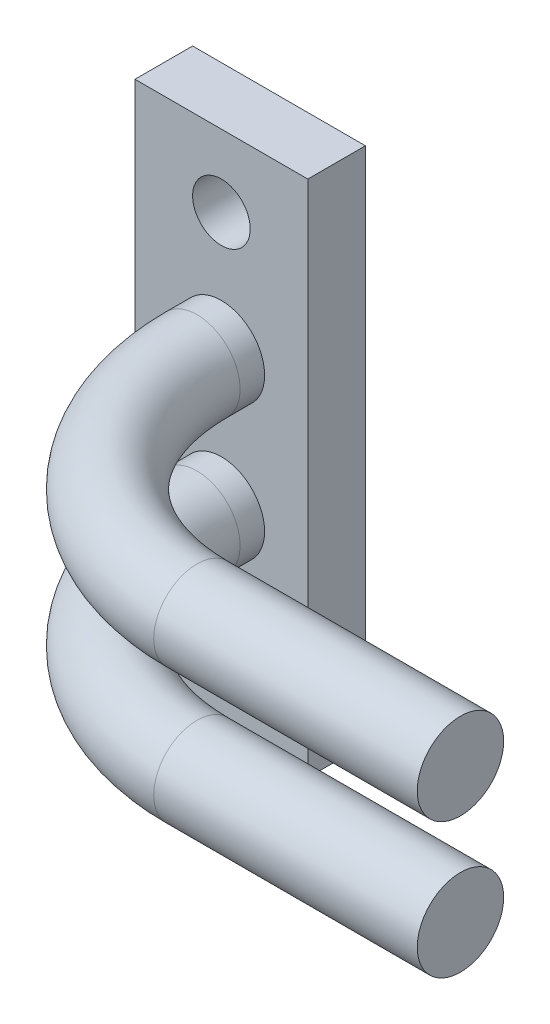
from build123d import *

# Parameters (mm, degrees)
SKETCH1_W           = 6
SKETCH1_H           = 18
BOSS_EXTRUDE1_DEPTH = 2
SKETCH2_R           = 1.5
BOSS_EXTRUDE2_DEPTH = 2.1
FILLET1_R           = 1.5
SKETCH3_R           = 1.5
SKETCH5_R           = 1
CUT_EXTRUDE1_DEPTH  = 22.33647117


with BuildPart() as part:
    # Sketch1 → Boss-Extrude1 (new body)
    with BuildSketch(Plane.XY):
        Rectangle(SKETCH1_W, SKETCH1_H)
    extrude(amount=BOSS_EXTRUDE1_DEPTH)

    # Sketch2 → Boss-Extrude2 (add)
    with BuildSketch(Plane(origin=(0, 0, 0), x_dir=(-1, 0, 0), z_dir=(0, 0, -1))):
        with Locations((0, 2.35)):
            Circle(SKETCH2_R)
        with Locations((0, -2.35)):
            Circle(SKETCH2_R)
    extrude(amount=BOSS_EXTRUDE2_DEPTH)

    # Fillet1
    fillet1_edges = [part.edges().sort_by_distance(p)[0] for p in [
        (1.5, 2.35, -2.1),
        (1.5, -2.35, -2.1),
    ]]
    fillet(fillet1_edges, radius=FILLET1_R)

    # Sweep1: sweep along a path in Sketch4
    with BuildLine(Plane(origin=(0, 2.35, 0), x_dir=(-1, 0, 0), z_dir=(0, 1, 0))) as sweep1_path:
        Line((0, 2), (0, 2.85))
        ThreePointArc((0, 2.85), (-2.196699141, 8.153300859), (-7.5, 10.35))
        Line((-7.5, 10.35), (-16.65, 10.35))
    # Sketch3 → Sweep1 (sweep)
    with BuildSketch(Plane.XY.offset(2)):
        with Locations((0, -2.35)):
            Circle(SKETCH3_R)
        with Locations((0, 2.35)):
            Circle(SKETCH3_R)
    sweep(path=sweep1_path.line)

    # Sketch5 → Cut-Extrude1 (cut, through all)
    with BuildSketch(Plane.XY.offset(2)):
        with Locations((0, 6.5)):
            Circle(SKETCH5_R)
        with Locations(Location((0, -6.5, 0), (0, 0, 180))):
            Circle(SKETCH5_R)
    extrude(amount=-CUT_EXTRUDE1_DEPTH, mode=Mode.SUBTRACT)


solid = part.part
